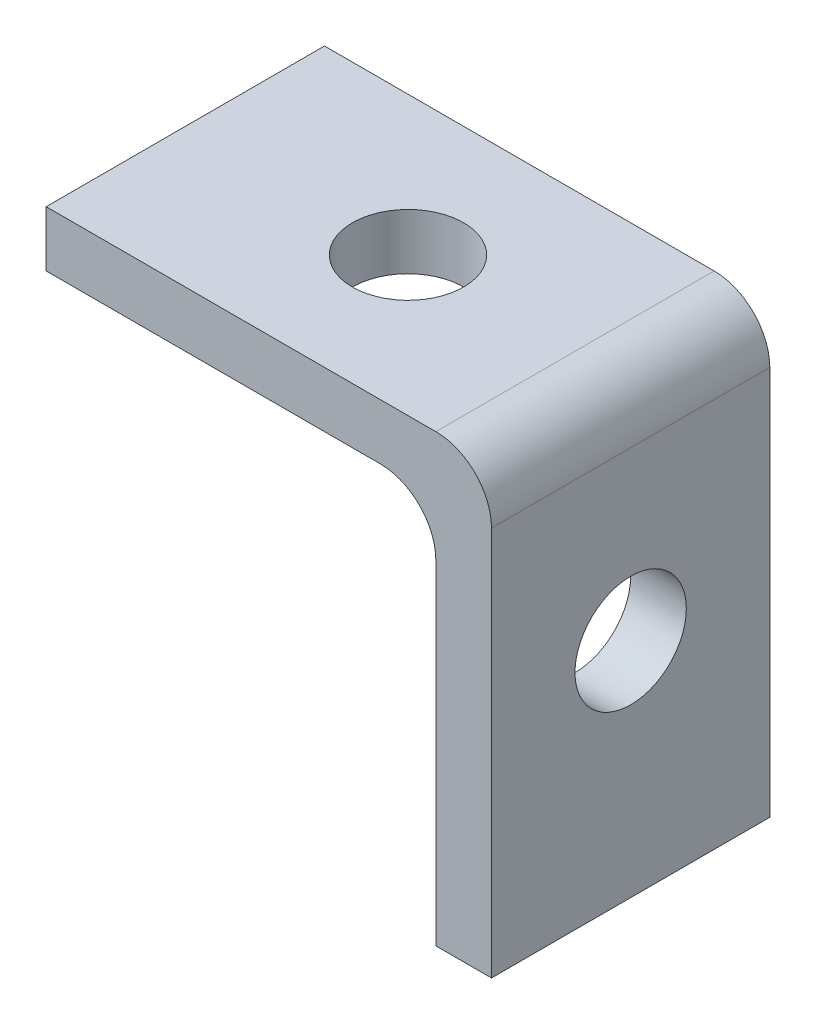
from build123d import *

# Parameters (mm, degrees)
BOSS_EXTRU_2_DEPTH      = 6
ESQUISSE3_R             = 1.2
ENL_V_MAT_EXTRU_1_DEPTH = 6
ESQUISSE4_R             = 1.2
ENL_V_MAT_EXTRU_2_DEPTH = 6


with BuildPart() as part:
    # Esquisse2 → Boss.-Extru.2 (new body)
    with BuildSketch(Plane.XY):
        with BuildLine():
            Line((-1.2, 0), (-9.6, 0))
            Line((-9.6, 0), (-9.6, -1.2))
            Line((-9.6, -1.2), (-2.4, -1.2))
            ThreePointArc((-2.4, -1.2), (-1.551471863, -1.551471863), (-1.2, -2.4))
            Line((-1.2, -2.4), (-1.2, -9.6))
            Line((-1.2, -9.6), (0, -9.6))
            Line((0, -9.6), (0, -1.2))
            ThreePointArc((0, -1.2), (-0.351471863, -0.351471863), (-1.2, 0))
        make_face()
    extrude(amount=BOSS_EXTRU_2_DEPTH)

    # Esquisse3 → Enlèv. mat.-Extru.1 (cut)
    with BuildSketch(Plane(origin=(0, 0, 0), x_dir=(1, 0, 0), z_dir=(0, 1, 0))):
        with Locations(Location((-4.8, -3, 0), (0, 0, 270))):
            Circle(ESQUISSE3_R)
    extrude(amount=-ENL_V_MAT_EXTRU_1_DEPTH, mode=Mode.SUBTRACT)

    # Esquisse4 → Enlèv. mat.-Extru.2 (cut)
    with BuildSketch(Plane(origin=(0, 0, 0), x_dir=(0, 0, -1), z_dir=(1, 0, 0))):
        with Locations((-3, -4.8)):
            Circle(ESQUISSE4_R)
    extrude(amount=-ENL_V_MAT_EXTRU_2_DEPTH, mode=Mode.SUBTRACT)


solid = part.part
